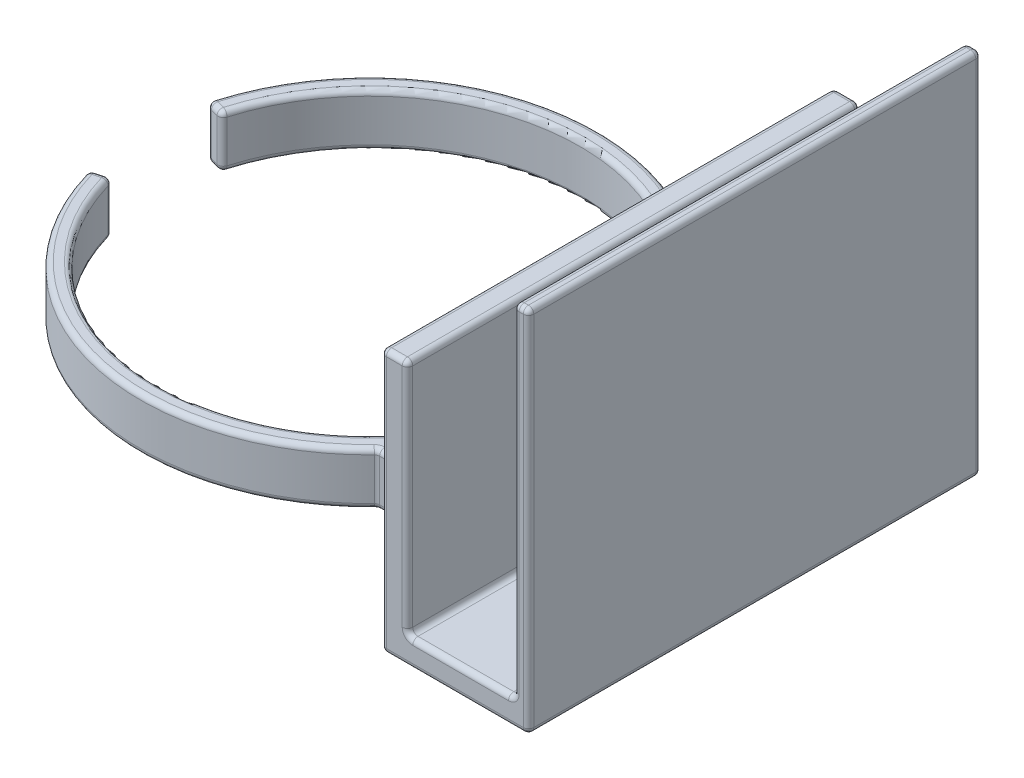
from build123d import *

# Parameters (mm, degrees)
BOSS_EXTRUDE1_DEPTH = 10
CUT_EXTRUDE2_DEPTH  = 86.744978244
SKETCH4_W           = 28
SKETCH4_H           = 43
BOSS_EXTRUDE2_DEPTH = 50
SKETCH5_W           = 28
SKETCH5_H           = 43
BOSS_EXTRUDE3_DEPTH = 10
SKETCH6_W           = 20.2
SKETCH6_H           = 43
CUT_EXTRUDE3_DEPTH  = 65
CUT_EXTRUDE4_REACH  = 116.461
SKETCH7_W           = 86
SKETCH7_H           = 20
FILLET5_R           = 1


with BuildPart() as part:
    # Sketch1 → Boss-Extrude1 (new body)
    with BuildSketch(Plane(origin=(0, 0, 0), x_dir=(1, 0, 0), z_dir=(0, 1, 0))):
        with BuildLine():
            Line((-43.5, 0), (73.211688234, 0))
            Line((73.211688234, 0), (73.211688234, 43))
            Line((73.211688234, 43), (45.211688234, 43))
            Line((45.211688234, 43), (45.211688234, 30))
            Line((45.211688234, 30), (31.5, 30))
            ThreePointArc((31.5, 30), (-16.155494421, 40.388736054), (-43.5, 0))
        make_face()
        with BuildLine():
            Line((45.211688234, 20), (45.211688234, 5))
            Line((45.211688234, 5), (43.211688234, 5))
            ThreePointArc((43.211688234, 5), (41.602298441, 12.708216414), (38.629651823, 20))
            Line((38.629651823, 20), (45.211688234, 20))
        make_face(mode=Mode.SUBTRACT)
    boss_extrude1 = extrude(amount=BOSS_EXTRUDE1_DEPTH)

    # Sketch3 → Cut-Extrude2 (cut, through all)
    with BuildSketch(Plane(origin=(0, 10, 0), x_dir=(1, 0, 0), z_dir=(0, 1, 0))):
        with BuildLine():
            Line((-42.017773444, 11.258628462), (-38.637033052, 10.352761804))
            ThreePointArc((-38.637033052, 10.352761804), (5.221047689, 39.657794455), (40, 0))
            Line((40, 0), (-43.5, 0))
            ThreePointArc((-43.5, 0), (-43.12785147, 5.677889362), (-42.017773444, 11.258628462))
        make_face()
    cut_extrude2 = extrude(amount=-CUT_EXTRUDE2_DEPTH, mode=Mode.SUBTRACT)

    # Sketch4 → Boss-Extrude2 (add)
    with BuildSketch(Plane(origin=(0, 10, 0), x_dir=(1, 0, 0), z_dir=(0, 1, 0))):
        with Locations((59.211688234, 21.5)):
            Rectangle(SKETCH4_W, SKETCH4_H)
    boss_extrude2 = extrude(amount=BOSS_EXTRUDE2_DEPTH)

    # Sketch5 → Boss-Extrude3 (add)
    with BuildSketch(Plane.XZ):
        with Locations((59.211688234, -21.5)):
            Rectangle(SKETCH5_W, SKETCH5_H)
    boss_extrude3 = extrude(amount=BOSS_EXTRUDE3_DEPTH)

    # Sketch6 → Cut-Extrude3 (cut)
    with BuildSketch(Plane(origin=(0, 60, 0), x_dir=(1, 0, 0), z_dir=(0, 1, 0))):
        with Locations((60.311688234, 21.5)):
            Rectangle(SKETCH6_W, SKETCH6_H)
    cut_extrude3 = extrude(amount=-CUT_EXTRUDE3_DEPTH, mode=Mode.SUBTRACT)

    # Mirror1: Boss-Extrude1, Cut-Extrude2, Boss-Extrude2, Boss-Extrude3, Cut-Extrude3 across plane
    add(boss_extrude1.mirror(Plane.XY))
    add(cut_extrude2.mirror(Plane.XY), mode=Mode.SUBTRACT)
    add(boss_extrude2.mirror(Plane.XY))
    add(boss_extrude3.mirror(Plane.XY))
    add(cut_extrude3.mirror(Plane.XY), mode=Mode.SUBTRACT)

    # Sketch7 → Cut-Extrude4 (cut, up to next)
    with BuildSketch(Plane.ZY.offset(-45.211688234), mode=Mode.PRIVATE) as cut_extrude4_sk1:
        with Locations((0, 50)):
            Rectangle(SKETCH7_W, SKETCH7_H)
    cut_extrude4_tool1 = extrude(cut_extrude4_sk1.sketch, amount=-CUT_EXTRUDE4_REACH, mode=Mode.PRIVATE) & part.part
    add(cut_extrude4_tool1.solids().sort_by_distance((45.211688, 50, 0))[0], mode=Mode.SUBTRACT)

    # Fillet5
    fillet5_edges = [part.edges().sort_by_distance(p)[0] for p in [
        (-10.745494001, 10, 42.151919988),
        (38.355844117, 10, 30),
        (31.5, 5, 30),
        (45.211688234, 5, 30),
        (73.211688234, 25, 43),
        (41.602298441, 10, 12.708216414),
        (44.211688234, 10, 5),
        (41.920670029, 10, 20),
        (-10.745494001, 0, 42.151919988),
        (38.355844117, 0, 30),
        (41.602298441, 0, 12.708216414),
        (38.629651823, 5, 20),
        (41.920670029, 0, 20),
        (45.211688234, 5, 20),
        (45.211688234, 5, 5),
        (44.211688234, 0, 5),
        (31.5, 5, -30),
        (43.211688234, 5, 5),
        (45.211688234, 5, -30),
        (73.211688234, 25, -43),
        (-42.017773444, 5, 11.258628462),
        (-38.637033052, 5, 10.352761804),
        (-40.327403248, 10, 10.805695133),
        (-40.327403248, 0, 10.805695133),
        (71.811688234, 60, 43),
        (45.211688234, 10, 25),
        (59.211688234, -10, 43),
        (45.211688234, 0, 25),
        (50.211688234, 17.5, 43),
        (70.411688234, 27.5, 43),
        (60.311688234, -5, 43),
        (41.602298441, 0, -12.708216414),
        (38.629651823, 5, -20),
        (44.211688234, 0, -5),
        (43.211688234, 5, -5),
        (45.211688234, 15, -43),
        (45.211688234, 15, 43),
        (45.211688234, 5, -5),
        (50.211688234, 40, 0),
        (47.711688234, 40, -43),
        (47.711688234, 40, 43),
        (41.920670029, 0, -20),
        (45.211688234, 40, 0),
        (45.211688234, 5, -20),
        (41.602298441, 10, -12.708216414),
        (44.211688234, 10, -5),
        (41.920670029, 10, -20),
        (38.355844117, 10, -30),
        (-40.327403248, 0, -10.805695133),
        (-42.017773444, 5, -11.258628462),
        (5.221047689, 0, 39.657794455),
        (-38.637033052, 5, -10.352761804),
        (5.221047689, 10, -39.657794455),
        (-40.327403248, 10, -10.805695133),
        (-10.745494001, 10, -42.151919988),
        (45.211688234, 10, 0),
        (45.211688234, 10, -25),
        (73.211688234, 60, 0),
        (71.811688234, 60, -43),
        (45.211688234, 0, -25),
        (45.211688234, 0, 0),
        (38.355844117, 0, -30),
        (73.211688234, -10, 0),
        (45.211688234, -10, 0),
        (59.211688234, -10, -43),
        (50.211688234, -5, 0),
        (60.311688234, -5, -43),
        (50.211688234, 17.5, -43),
        (70.411688234, -5, 0),
        (70.411688234, 27.5, -43),
        (-10.745494001, 0, -42.151919988),
        (70.411688234, 60, 0),
    ]]
    fillet(fillet5_edges, radius=FILLET5_R)


solid = part.part
